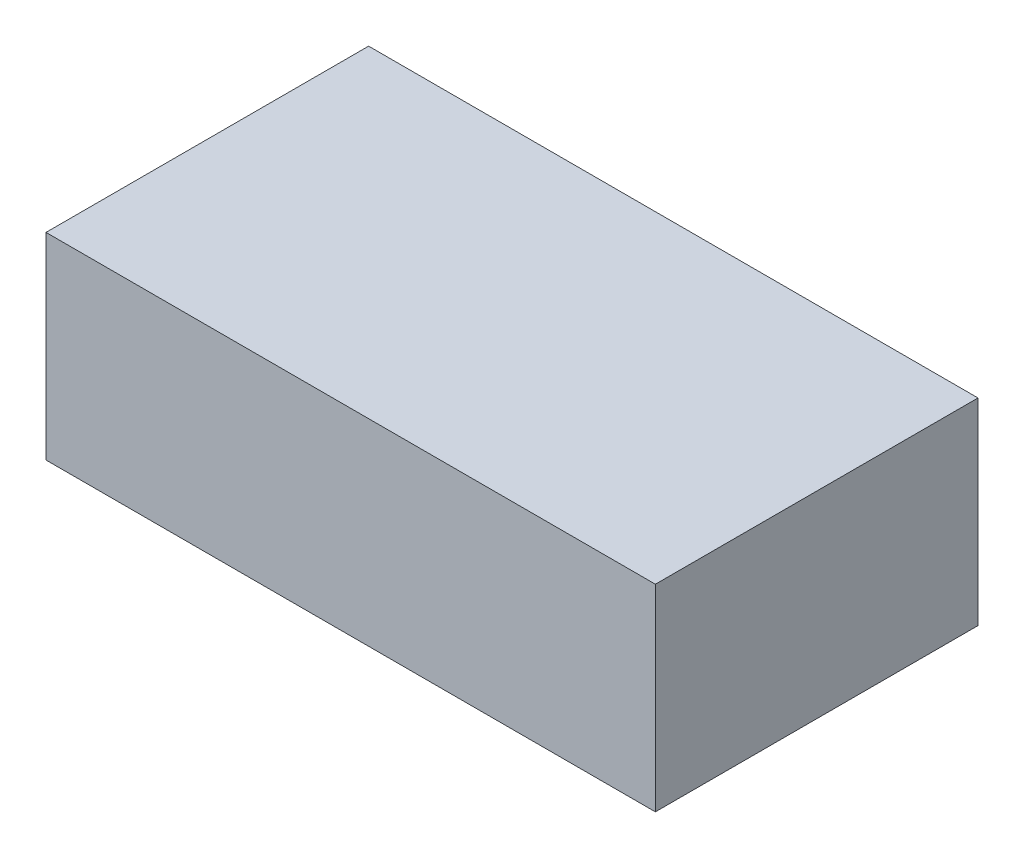
from build123d import *

# Parameters (mm, degrees)
SKETCH1_W           = 34
SKETCH1_H           = 18
BOSS_EXTRUDE1_DEPTH = 11


with BuildPart() as part:
    # Sketch1 → Boss-Extrude1 (new body)
    with BuildSketch(Plane(origin=(0, 12, 0), x_dir=(1, 0, 0), z_dir=(0, 1, 0))):
        with Locations((20, 14)):
            Rectangle(SKETCH1_W, SKETCH1_H)
    extrude(amount=BOSS_EXTRUDE1_DEPTH)


solid = part.part
